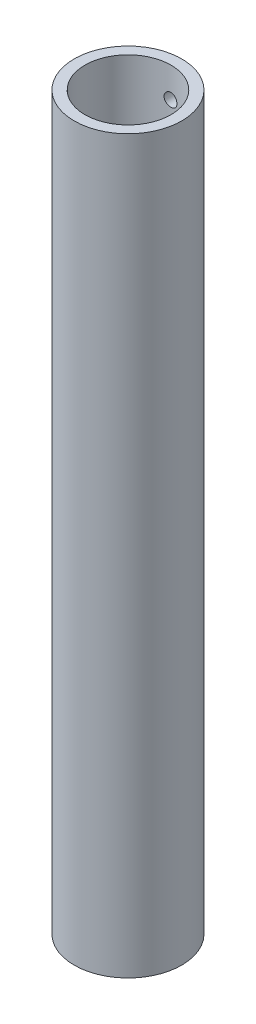
from build123d import *

# Parameters (mm, degrees)
SKETCH1_R           = 12.5
SKETCH1_R_2         = 10
BOSS_EXTRUDE1_DEPTH = 170
SKETCH2_R           = 1.5
CUT_EXTRUDE1_DEPTH  = 10


with BuildPart() as part:
    # Sketch1 → Boss-Extrude1 (new body)
    with BuildSketch(Plane(origin=(0, 0, 0), x_dir=(1, 0, 0), z_dir=(0, 1, 0))):
        with Locations(Location((0, 0, 0), (0, 0, 270))):
            Circle(SKETCH1_R)
        with Locations(Location((0, 0, 0), (0, 0, 270))):
            Circle(SKETCH1_R_2, mode=Mode.SUBTRACT)
    extrude(amount=BOSS_EXTRUDE1_DEPTH)

    # Sketch2 → Cut-Extrude1 (cut)
    with BuildSketch(Plane(origin=(0, 0, -12.5), x_dir=(-1, 0, 0), z_dir=(0, 0, -1))):
        with Locations(Location((0, 163, 0), (0, 0, 90))):
            Circle(SKETCH2_R)
    extrude(amount=-CUT_EXTRUDE1_DEPTH, mode=Mode.SUBTRACT)


solid = part.part
